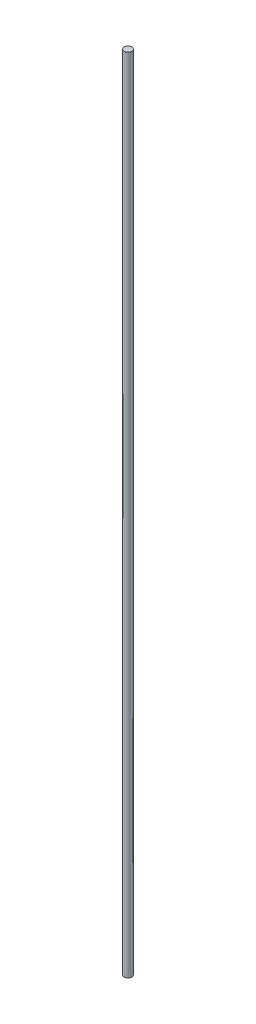
from build123d import *

# Parameters (mm, degrees)
SKETCH1_R           = 4.7625
BOSS_EXTRUDE1_DEPTH = 500


with BuildPart() as part:
    # Sketch1 → Boss-Extrude1 (new, symmetric)
    with BuildSketch(Plane(origin=(0, 0, 0), x_dir=(1, 0, 0), z_dir=(0, 1, 0))):
        with Locations(Location((0, 0, 0), (0, 0, 270))):
            Circle(SKETCH1_R)
    extrude(amount=BOSS_EXTRUDE1_DEPTH, both=True)


solid = part.part
